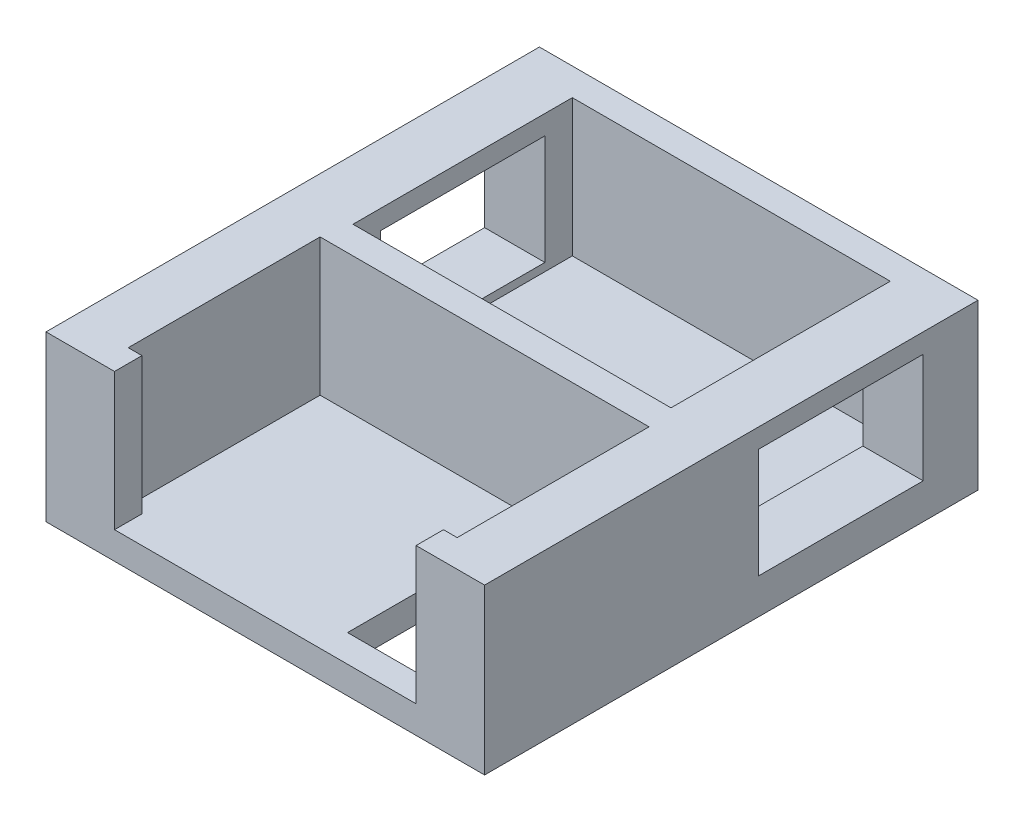
from build123d import *

# Parameters (mm, degrees)
SKETCH2_W          = 80
SKETCH2_H          = 100
SKETCH2_R          = 10
CAMERA_LENSE_DEPTH = 5
SKETCH3_W          = 80
SKETCH3_H          = 100
SKETCH3_W_2        = 58
SKETCH3_H_2        = 40
SKETCH3_W_3        = 60
SKETCH3_H_3        = 35
CAMERA_DEPTH       = 25
HOLLOW_START       = -2
SKETCH4_W          = 78
SKETCH4_H          = 27.979664862
HOLLOW_TOP_DEPTH   = 8
SKETCH10_W         = 80
SKETCH10_H         = 10
CUT_EXTRUDE4_DEPTH = 101.201733938
SKETCH11_W         = 30
SKETCH11_H         = 20
CUT_EXTRUDE5_DEPTH = 122.023203799
SKETCH12_W         = 20
SKETCH12_H         = 35
CUT_EXTRUDE6_DEPTH = 99.819975127
SKETCH13_W         = 55
SKETCH13_H         = 25
CUT_EXTRUDE7_DEPTH = 10


with BuildPart() as part:
    # Sketch2 → camera lense (new body)
    with BuildSketch(Plane(origin=(0, 0, 0), x_dir=(1, 0, 0), z_dir=(0, 1, 0))):
        with Locations((2.352941176, -35.712402007)):
            Rectangle(SKETCH2_W, SKETCH2_H)
        with Locations(Location((16.352941176, -25.712402007, 0), (0, 0, 270))):
            Circle(SKETCH2_R, mode=Mode.SUBTRACT)
    extrude(amount=CAMERA_LENSE_DEPTH)

    # Sketch3 → camera (add)
    with BuildSketch(Plane(origin=(0, 5, 0), x_dir=(1, 0, 0), z_dir=(0, 1, 0))):
        with Locations((2.352941176, -35.712402007)):
            Rectangle(SKETCH3_W, SKETCH3_H)
        with Locations((2.352941176, -20.712402007)):
            Rectangle(SKETCH3_W_2, SKETCH3_H_2, mode=Mode.SUBTRACT)
        with Locations((2.352941176, -63.212402007)):
            Rectangle(SKETCH3_W_3, SKETCH3_H_3, mode=Mode.SUBTRACT)
    extrude(amount=CAMERA_DEPTH)

    # Sketch4 → hollow top (cut)
    with BuildSketch(Plane(origin=(0, 0, -14.287597993), x_dir=(-1, 0, 0), z_dir=(0, 0, -1)).offset(HOLLOW_START)):
        with Locations((-2.352941176, 14.989832431)):
            Rectangle(SKETCH4_W, SKETCH4_H)
    extrude(amount=-HOLLOW_TOP_DEPTH, mode=Mode.SUBTRACT)

    # Sketch10 → Cut-Extrude4 (cut, through all)
    with BuildSketch(Plane(origin=(0, 30, 0), x_dir=(1, 0, 0), z_dir=(0, 1, 0))):
        with Locations((2.352941176, 9.287597993)):
            Rectangle(SKETCH10_W, SKETCH10_H)
    extrude(amount=-CUT_EXTRUDE4_DEPTH, mode=Mode.SUBTRACT)

    # Sketch11 → Cut-Extrude5 (cut, through all)
    with BuildSketch(Plane(origin=(42.352941176, 0, 0), x_dir=(0, 0, -1), z_dir=(1, 0, 0))):
        with Locations((-20.712402007, 16.465766073)):
            Rectangle(SKETCH11_W, SKETCH11_H)
    extrude(amount=-CUT_EXTRUDE5_DEPTH, mode=Mode.SUBTRACT)

    # Sketch12 → Cut-Extrude6 (cut, through all)
    with BuildSketch(Plane(origin=(0, 5, 0), x_dir=(1, 0, 0), z_dir=(0, 1, 0))):
        with Locations((22.352941176, -63.212402007)):
            Rectangle(SKETCH12_W, SKETCH12_H)
    extrude(amount=-CUT_EXTRUDE6_DEPTH, mode=Mode.SUBTRACT)

    # Sketch13 → Cut-Extrude7 (cut)
    with BuildSketch(Plane.XY.offset(85.712402007)):
        with Locations((2.352941176, 17.5)):
            Rectangle(SKETCH13_W, SKETCH13_H)
    extrude(amount=-CUT_EXTRUDE7_DEPTH, mode=Mode.SUBTRACT)


solid = part.part
